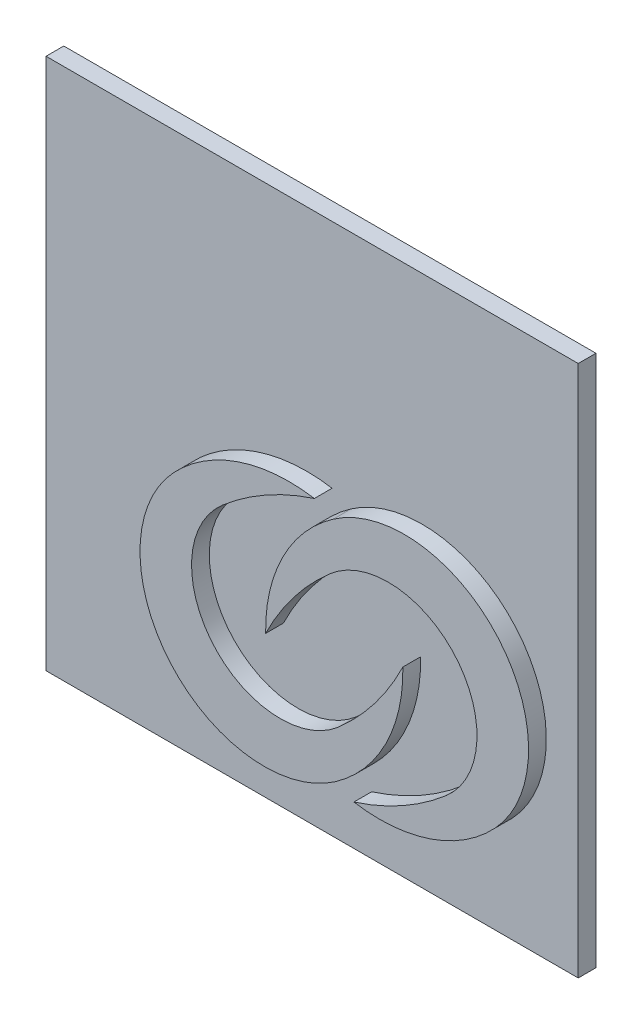
from build123d import *

# Parameters (mm, degrees)
SKICA1_W                = 300
SKICA1_H                = 300
P_IDAT_VYSUNUT_M1_DEPTH = 10
P_IDAT_VYSUNUT_M3_DEPTH = 10


with BuildPart() as part:
    # Skica1 → Přidat vysunutím1 (new body)
    with BuildSketch(Plane.XY):
        with Locations((150, 150)):
            Rectangle(SKICA1_W, SKICA1_H)
    extrude(amount=P_IDAT_VYSUNUT_M1_DEPTH)

    # Skica3 → Přidat vysunutím3 (add)
    with BuildSketch(Plane.XY.offset(10)):
        with BuildLine():
            ThreePointArc((161.258214426, 169.732529164), (118.091173044, 166.070333412), (81.747818606, 142.491407915))
            ThreePointArc((81.747818606, 142.491407915), (80.157704047, 48.826419384), (173.139331363, 37.421353736))
            ThreePointArc((173.139331363, 37.421353736), (201.527121298, 70.146550787), (211.135953458, 112.38960328))
            ThreePointArc((211.135953458, 112.38960328), (195.41469161, 86.876535147), (174.935524438, 64.997814169))
            ThreePointArc((174.935524438, 64.997814169), (104.302093893, 69.827572661), (109.307122532, 140.448800107))
            ThreePointArc((109.307122532, 140.448800107), (133.812696433, 157.698483219), (161.258214426, 169.732529164))
        make_face()
        with BuildLine():
            ThreePointArc((263.117659489, 59.733740684), (226.718588511, 36.240916857), (183.542998572, 32.680920678))
            ThreePointArc((183.542998572, 32.680920678), (211.01692785, 44.649961145), (235.56326825, 61.841583891))
            ThreePointArc((235.56326825, 61.841583891), (240.735464455, 132.450765052), (170.113665313, 137.447720489))
            ThreePointArc((170.113665313, 137.447720489), (149.582762041, 115.617541137), (133.801147174, 90.141761426))
            ThreePointArc((133.801147174, 90.141761426), (143.509954364, 132.361948569), (171.975135093, 165.019851524))
            ThreePointArc((171.975135093, 165.019851524), (264.929502664, 153.394702482), (263.117659489, 59.733740684))
        make_face()
    extrude(amount=P_IDAT_VYSUNUT_M3_DEPTH)


solid = part.part
